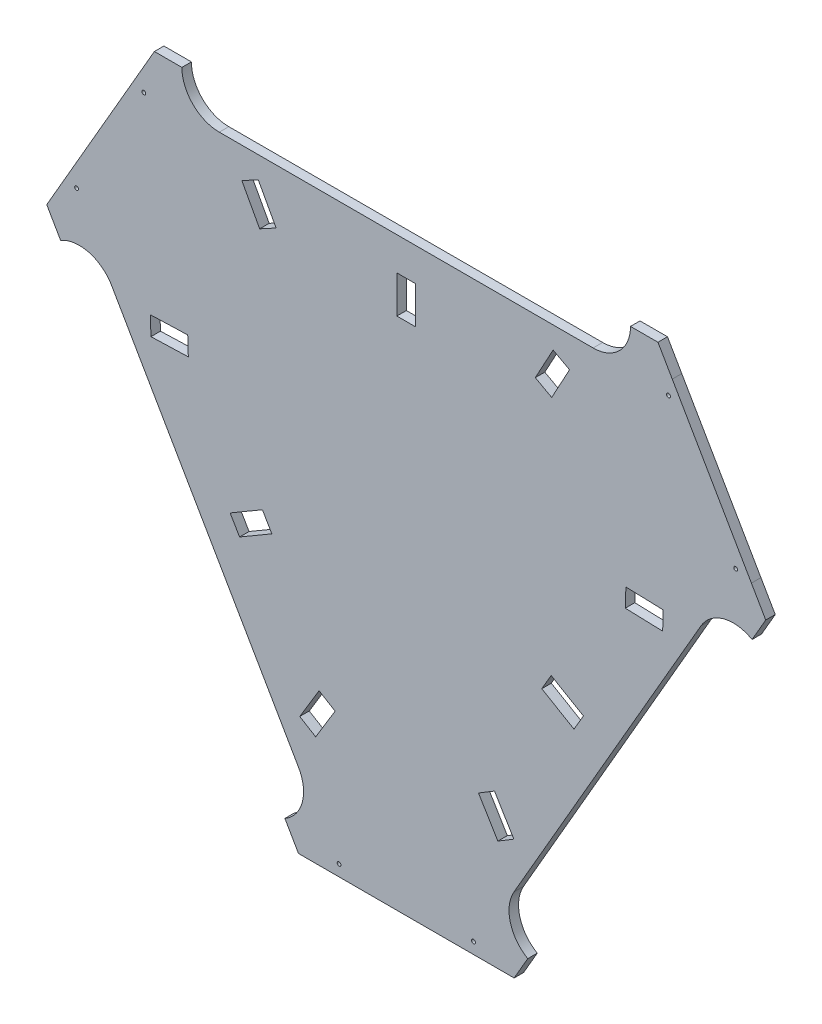
from build123d import *

# Parameters (mm, degrees)
MODEL_R            = 2
MODEL_W            = 19.645816046
MODEL_H            = 39.291293686
BOSS_EXTRU_1_DEPTH = 10


with BuildPart() as part:
    # Model → Boss.-Extru.1 (new body)
    with BuildSketch(Plane.XY):
        with BuildLine():
            Line((682.695045286, -1946.855082062), (879.151513744, -2287.127966132))
            add(Edge.make_bspline(
                [(879.151513744, -2287.127966132), (889.999791642, -2305.917615253), (883.561957827, -2329.943588049), (864.772308706, -2340.79203515)],
                knots=[1, 1, 1, 1, 2, 2, 2, 2], degree=3))
            Line((864.772308706, -2340.79203515), (879.080786919, -2365.574852737))
            Line((879.080786919, -2365.574852737), (909.407369941, -2365.574852737))
            Line((909.407369941, -2365.574852737), (1075.393432839, -2365.574852737))
            Line((1075.393432839, -2365.574852737), (1105.720015861, -2365.574852737))
            Line((1105.720015861, -2365.574852737), (1120.02849407, -2340.792035147))
            add(Edge.make_bspline(
                [(1120.02849407, -2340.792035147), (1101.238844947, -2329.94358805), (1094.801011127, -2305.917615255), (1105.649289021, -2287.127966132)],
                knots=[7, 7, 7, 7, 8, 8, 8, 8], degree=3))
            Line((1105.649289021, -2287.127966132), (1302.105757418, -1946.855082026))
            add(Edge.make_bspline(
                [(1302.105757418, -1946.855082026), (1312.954035312, -1928.065432904), (1336.980177311, -1921.627768287), (1355.769826434, -1932.475876978)],
                knots=[9, 9, 9, 9, 10, 10, 10, 10], degree=3))
            Line((1355.769826434, -1932.475876978), (1370.178134382, -1907.519964771))
            Line((1370.178134382, -1907.519964771), (1355.114672609, -1881.429377608))
            Line((1355.114672609, -1881.429377608), (1271.929088191, -1737.347990137))
            Line((1271.929088191, -1737.347990137), (1256.886607583, -1711.292935573))
            Line((1256.886607583, -1711.292935573), (1228.035135874, -1711.292935573))
            add(Edge.make_bspline(
                [(1228.035135874, -1711.292935573), (1228.035135876, -1732.992875424), (1210.443782043, -1750.58422926), (1188.743842192, -1750.584229262)],
                knots=[17, 17, 17, 17, 18, 18, 18, 18], degree=3))
            Line((1188.743842192, -1750.584229262), (795.830566931, -1750.584229262))
            add(Edge.make_bspline(
                [(795.830566931, -1750.584229262), (774.13062708, -1750.584229264), (756.539273244, -1732.992875431), (756.539273242, -1711.29293558)],
                knots=[19, 19, 19, 19, 20, 20, 20, 20], degree=3))
            Line((756.539273242, -1711.29293558), (727.617413106, -1711.29293558))
            Line((727.617413106, -1711.29293558), (614.474446531, -1907.262945538))
            Line((614.474446531, -1907.262945538), (629.030976268, -1932.475877023))
            add(Edge.make_bspline(
                [(629.030976268, -1932.475877023), (647.820625389, -1921.627599125), (671.846767389, -1928.065432941), (682.695045286, -1946.855082062)],
                knots=[23, 23, 23, 23, 24, 24, 24, 24], degree=3))
        make_face()
        with Locations((716.491657861, -1754.205060963)):
            Circle(MODEL_R, mode=Mode.SUBTRACT)
        with Locations((645.852191539, -1876.556374988)):
            Circle(MODEL_R, mode=Mode.SUBTRACT)
        with Locations((921.760877273, -2353.746974362)):
            Circle(MODEL_R, mode=Mode.SUBTRACT)
        with Locations((1063.039925504, -2353.746974349)):
            Circle(MODEL_R, mode=Mode.SUBTRACT)
        with Locations((1338.602199082, -1876.556405894)):
            Circle(MODEL_R, mode=Mode.SUBTRACT)
        with Locations((1267.962617169, -1754.205060913)):
            Circle(MODEL_R, mode=Mode.SUBTRACT)
        Polygon((1223.175627189, -1950.912568739), (1262.446954927, -1952.164332155), (1261.821242422, -1971.799996024), (1222.549576279, -1970.548232608), align=None, mode=Mode.SUBTRACT)
        Polygon((1168.677387646, -2107.576225944), (1134.756257166, -2087.748009122), (1144.67053478, -2070.787443882), (1178.59166526, -2090.615660704), align=None, mode=Mode.SUBTRACT)
        Polygon((1146.688110722, -1773.475865452), (1163.955948518, -1782.84480196), (1145.218413907, -1817.380308349), (1127.950576111, -1808.011541044), align=None, mode=Mode.SUBTRACT)
        Polygon((1085.080978488, -2205.721381517), (1105.440492577, -2239.326440884), (1088.637962894, -2249.506197929), (1068.278448805, -2215.901138562), align=None, mode=Mode.SUBTRACT)
        with Locations((992.287035365, -1805.015464432)):
            Rectangle(MODEL_W, MODEL_H, mode=Mode.SUBTRACT)
        Polygon((900.740118048, -2206.587700635), (917.542647733, -2216.767457676), (897.18313365, -2250.372517047), (880.380603964, -2240.192760005), align=None, mode=Mode.SUBTRACT)
        Polygon((836.808814024, -1773.475865479), (855.54634864, -1808.011541068), (838.278510846, -1817.380308376), (819.540976229, -1782.844801991), align=None, mode=Mode.SUBTRACT)
        Polygon((841.150900137, -2071.65376301), (851.065177754, -2088.614328248), (817.144047278, -2108.442545076), (807.229769661, -2091.481979838), align=None, mode=Mode.SUBTRACT)
        Polygon((762.645807706, -1951.778887881), (763.271520215, -1971.41455175), (724.000192478, -1972.666315173), (723.374479969, -1953.030651304), align=None, mode=Mode.SUBTRACT)
    extrude(amount=BOSS_EXTRU_1_DEPTH)


solid = part.part
